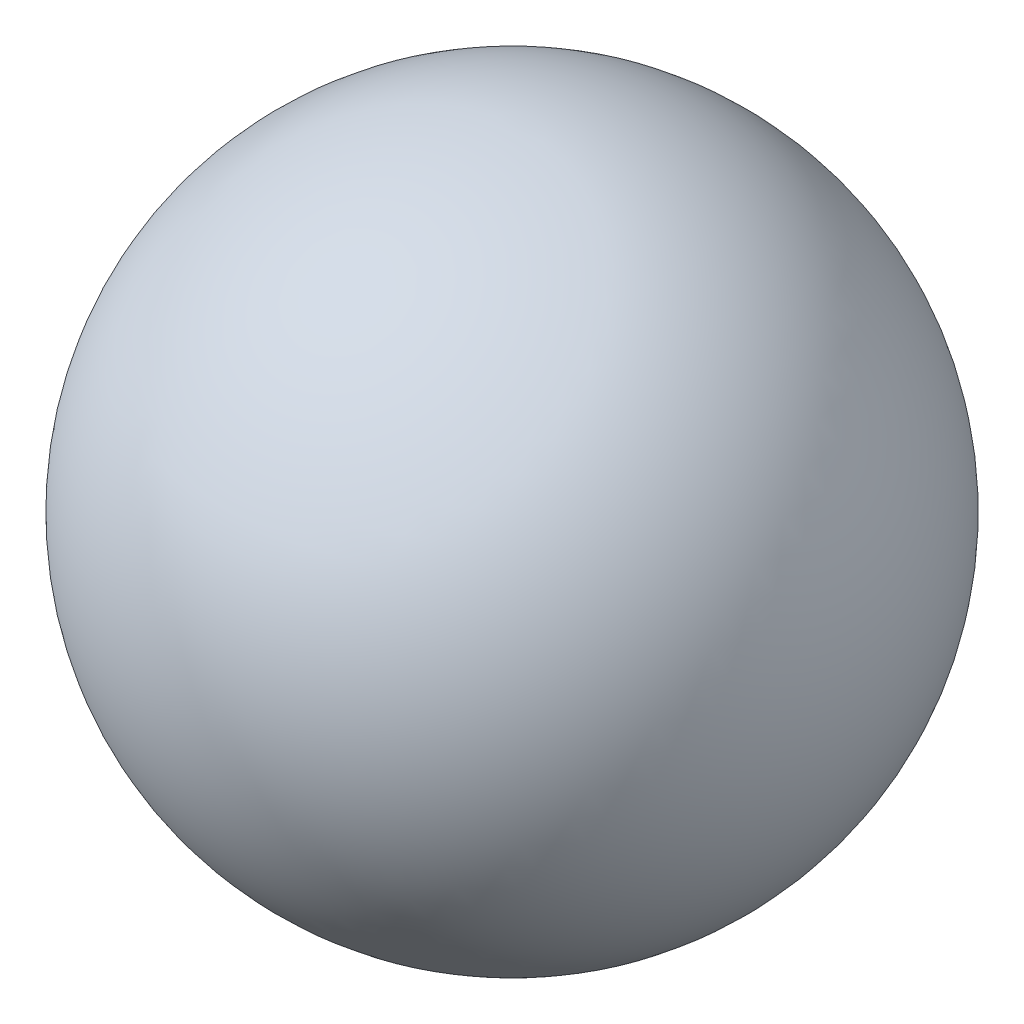
from build123d import *


with BuildPart() as part:
    # Sketch1 → Revolve1 (revolve)
    with BuildSketch(Plane.XY):
        with BuildLine():
            Line((0, 20.75), (0, -20.75))
            ThreePointArc((0, -20.75), (20.75, 0), (0, 20.75))
        make_face()
    revolve(axis=Axis((0, 20.75, 0), (0, -1, 0)))


solid = part.part
